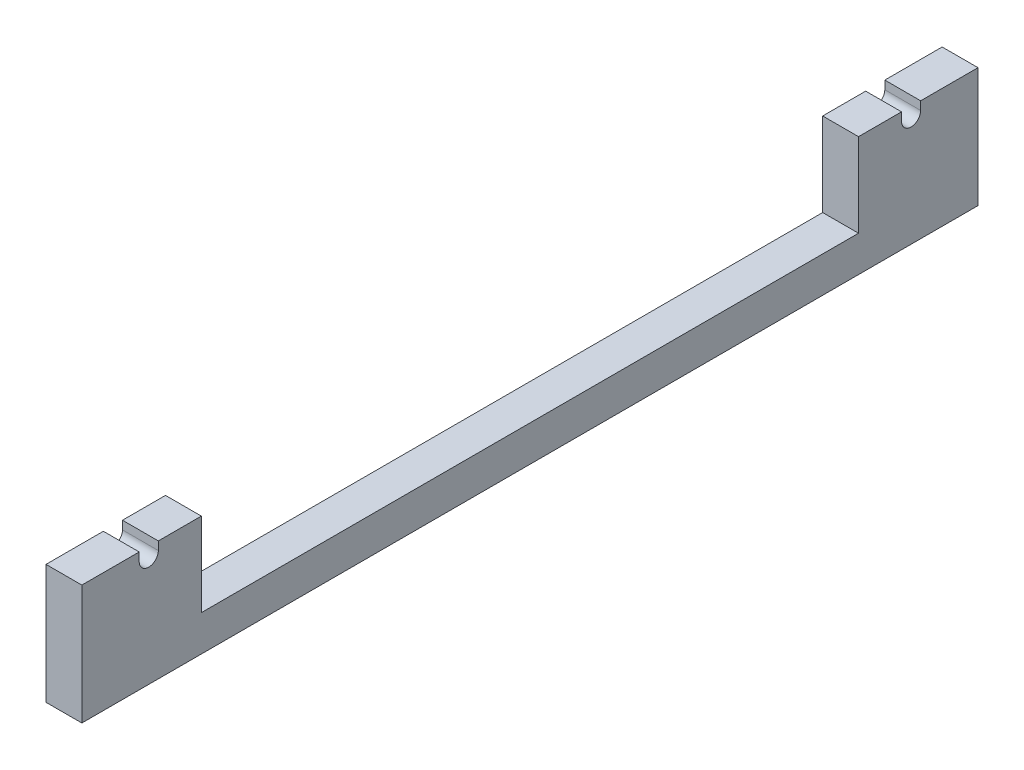
from build123d import *

# Parameters (mm, degrees)
SALIENTE_EXTRUIR3_DEPTH = 15


with BuildPart() as part:
    # Croquis2 → Saliente-Extruir3 (new body)
    with BuildSketch(Plane(origin=(0, 0, 0), x_dir=(0, 0, -1), z_dir=(1, 0, 0))):
        with BuildLine():
            Line((0, 0), (375, 0))
            Line((375, 0), (375, 50))
            Line((375, 50), (351, 50))
            Line((351, 50), (351, 46.5))
            ThreePointArc((351, 46.5), (347, 42.5), (343, 46.5))
            Line((343, 46.5), (343, 50))
            Line((343, 50), (325, 50))
            Line((325, 50), (325, 15))
            Line((325, 15), (50, 15))
            Line((50, 15), (50, 50))
            Line((50, 50), (32, 50))
            Line((32, 50), (32, 46.5))
            ThreePointArc((32, 46.5), (28, 42.5), (24, 46.5))
            Line((24, 46.5), (24, 50))
            Line((24, 50), (0, 50))
            Line((0, 50), (0, 0))
        make_face()
    extrude(amount=SALIENTE_EXTRUIR3_DEPTH)


solid = part.part
